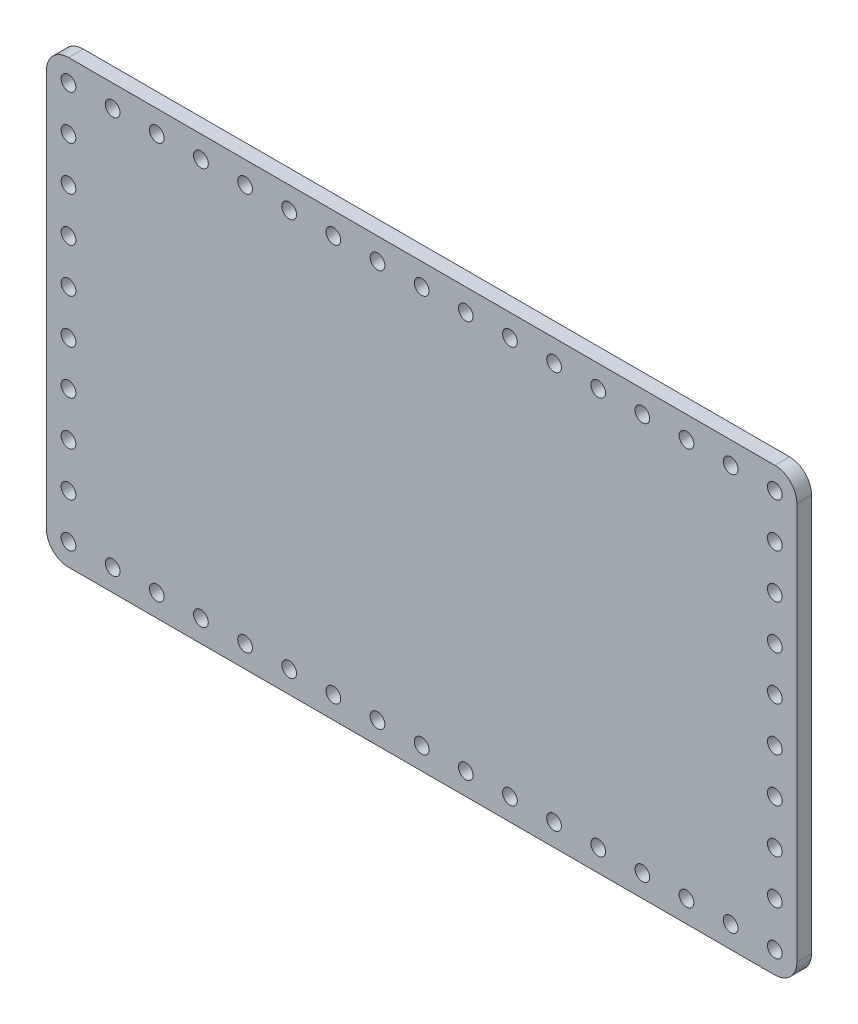
from build123d import *

# Parameters (mm, degrees)
MODEL_R                 = 1.5
SALIENTE_EXTRUIR1_DEPTH = 3


with BuildPart() as part:
    # Model → Saliente-Extruir1 (new body)
    with BuildSketch(Plane.XY):
        with BuildLine():
            Line((404.929131311, 485.242243614), (404.929131311, 404.242243614))
            ThreePointArc((404.929131311, 404.242243614), (403.611111826, 401.060263099), (400.429131311, 399.742243614))
            Line((400.429131311, 399.742243614), (256.429131311, 399.742243614))
            ThreePointArc((256.429131311, 399.742243614), (253.247150795, 401.060263099), (251.929131311, 404.242243614))
            Line((251.929131311, 404.242243614), (251.929131311, 485.242243614))
            ThreePointArc((251.929131311, 485.242243614), (253.247150795, 488.424224129), (256.429131311, 489.742243614))
            Line((256.429131311, 489.742243614), (400.429131311, 489.742243614))
            ThreePointArc((400.429131311, 489.742243614), (403.611111826, 488.424224129), (404.929131311, 485.242243614))
        make_face()
        with Locations((400.429131311, 485.242243614)):
            Circle(MODEL_R, mode=Mode.SUBTRACT)
        with Locations((400.429131311, 476.242243614)):
            Circle(MODEL_R, mode=Mode.SUBTRACT)
        with Locations((400.429131311, 467.242243614)):
            Circle(MODEL_R, mode=Mode.SUBTRACT)
        with Locations((400.429131311, 458.242243614)):
            Circle(MODEL_R, mode=Mode.SUBTRACT)
        with Locations((400.429131311, 449.242243614)):
            Circle(MODEL_R, mode=Mode.SUBTRACT)
        with Locations((400.429131311, 440.242243614)):
            Circle(MODEL_R, mode=Mode.SUBTRACT)
        with Locations((400.429131311, 431.242243614)):
            Circle(MODEL_R, mode=Mode.SUBTRACT)
        with Locations((400.429131311, 422.242243614)):
            Circle(MODEL_R, mode=Mode.SUBTRACT)
        with Locations((400.429131311, 413.242243614)):
            Circle(MODEL_R, mode=Mode.SUBTRACT)
        with Locations((400.429131311, 404.242243614)):
            Circle(MODEL_R, mode=Mode.SUBTRACT)
        with Locations((256.429131311, 485.242243614)):
            Circle(MODEL_R, mode=Mode.SUBTRACT)
        with Locations((256.429131311, 476.242243614)):
            Circle(MODEL_R, mode=Mode.SUBTRACT)
        with Locations((256.429131311, 467.242243614)):
            Circle(MODEL_R, mode=Mode.SUBTRACT)
        with Locations((256.429131311, 458.242243614)):
            Circle(MODEL_R, mode=Mode.SUBTRACT)
        with Locations((256.429131311, 449.242243614)):
            Circle(MODEL_R, mode=Mode.SUBTRACT)
        with Locations((256.429131311, 440.242243614)):
            Circle(MODEL_R, mode=Mode.SUBTRACT)
        with Locations((256.429131311, 431.242243614)):
            Circle(MODEL_R, mode=Mode.SUBTRACT)
        with Locations((256.429131311, 422.242243614)):
            Circle(MODEL_R, mode=Mode.SUBTRACT)
        with Locations((256.429131311, 413.242243614)):
            Circle(MODEL_R, mode=Mode.SUBTRACT)
        with Locations((256.429131311, 404.242243614)):
            Circle(MODEL_R, mode=Mode.SUBTRACT)
        with Locations((265.429131311, 485.242243614)):
            Circle(MODEL_R, mode=Mode.SUBTRACT)
        with Locations((265.429131311, 404.242243614)):
            Circle(MODEL_R, mode=Mode.SUBTRACT)
        with Locations((274.429131311, 485.242243614)):
            Circle(MODEL_R, mode=Mode.SUBTRACT)
        with Locations((274.429131311, 404.242243614)):
            Circle(MODEL_R, mode=Mode.SUBTRACT)
        with Locations((283.429131311, 485.242243614)):
            Circle(MODEL_R, mode=Mode.SUBTRACT)
        with Locations((283.429131311, 404.242243614)):
            Circle(MODEL_R, mode=Mode.SUBTRACT)
        with Locations((292.429131311, 485.242243614)):
            Circle(MODEL_R, mode=Mode.SUBTRACT)
        with Locations((292.429131311, 404.242243614)):
            Circle(MODEL_R, mode=Mode.SUBTRACT)
        with Locations((301.429131311, 485.242243614)):
            Circle(MODEL_R, mode=Mode.SUBTRACT)
        with Locations((301.429131311, 404.242243614)):
            Circle(MODEL_R, mode=Mode.SUBTRACT)
        with Locations((310.429131311, 485.242243614)):
            Circle(MODEL_R, mode=Mode.SUBTRACT)
        with Locations((310.429131311, 404.242243614)):
            Circle(MODEL_R, mode=Mode.SUBTRACT)
        with Locations((319.429131311, 485.242243614)):
            Circle(MODEL_R, mode=Mode.SUBTRACT)
        with Locations((319.429131311, 404.242243614)):
            Circle(MODEL_R, mode=Mode.SUBTRACT)
        with Locations((328.429131311, 485.242243614)):
            Circle(MODEL_R, mode=Mode.SUBTRACT)
        with Locations((328.429131311, 404.242243614)):
            Circle(MODEL_R, mode=Mode.SUBTRACT)
        with Locations((337.429131311, 485.242243614)):
            Circle(MODEL_R, mode=Mode.SUBTRACT)
        with Locations((337.429131311, 404.242243614)):
            Circle(MODEL_R, mode=Mode.SUBTRACT)
        with Locations((346.429131311, 485.242243614)):
            Circle(MODEL_R, mode=Mode.SUBTRACT)
        with Locations((346.429131311, 404.242243614)):
            Circle(MODEL_R, mode=Mode.SUBTRACT)
        with Locations((355.429131311, 485.242243614)):
            Circle(MODEL_R, mode=Mode.SUBTRACT)
        with Locations((355.429131311, 404.242243614)):
            Circle(MODEL_R, mode=Mode.SUBTRACT)
        with Locations((364.429131311, 485.242243614)):
            Circle(MODEL_R, mode=Mode.SUBTRACT)
        with Locations((364.429131311, 404.242243614)):
            Circle(MODEL_R, mode=Mode.SUBTRACT)
        with Locations((373.429131311, 485.242243614)):
            Circle(MODEL_R, mode=Mode.SUBTRACT)
        with Locations((373.429131311, 404.242243614)):
            Circle(MODEL_R, mode=Mode.SUBTRACT)
        with Locations((382.429131311, 485.242243614)):
            Circle(MODEL_R, mode=Mode.SUBTRACT)
        with Locations((382.429131311, 404.242243614)):
            Circle(MODEL_R, mode=Mode.SUBTRACT)
        with Locations((391.429131311, 485.242243614)):
            Circle(MODEL_R, mode=Mode.SUBTRACT)
        with Locations((391.429131311, 404.242243614)):
            Circle(MODEL_R, mode=Mode.SUBTRACT)
    extrude(amount=SALIENTE_EXTRUIR1_DEPTH)


solid = part.part
